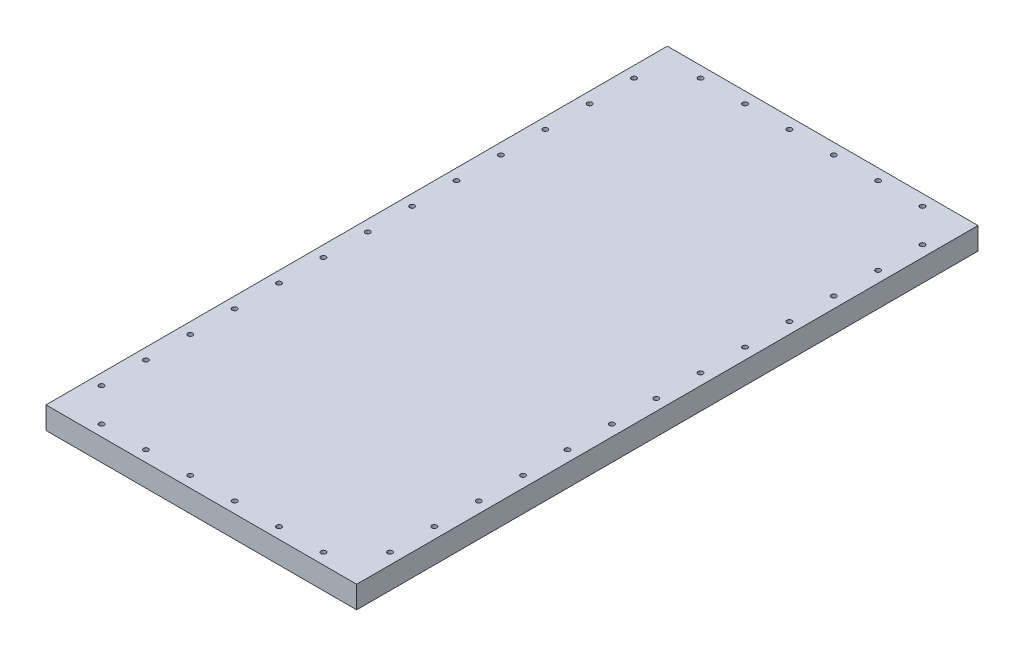
from build123d import *

# Parameters (mm, degrees)
SKETCH1_W                                         = 533.4
SKETCH1_H                                         = 38.1
BOSS_EXTRUDE1_DEPTH                               = 1066.8
CSK_FOR_5_16_FLAT_HEAD_MACHINE_SCREW1_D           = 8.4328
CSK_FOR_5_16_FLAT_HEAD_MACHINE_SCREW1_CSINK_D     = 16.129
CSK_FOR_5_16_FLAT_HEAD_MACHINE_SCREW1_CSINK_ANGLE = 82
CSK_FOR_5_16_FLAT_HEAD_MACHINE_SCREW2_D           = 8.4328
CSK_FOR_5_16_FLAT_HEAD_MACHINE_SCREW2_CSINK_D     = 16.129
CSK_FOR_5_16_FLAT_HEAD_MACHINE_SCREW2_CSINK_ANGLE = 82


with BuildPart() as part:
    # Sketch1 → Boss-Extrude1 (new body)
    with BuildSketch(Plane.XY):
        Rectangle(SKETCH1_W, SKETCH1_H)
    extrude(amount=BOSS_EXTRUDE1_DEPTH)

    # CSK for 5/16 Flat Head Machine Screw1 (through all)
    with Locations(Plane(origin=(0, -19.05, 0), x_dir=(-1, 0, 0), z_dir=(0, -1, 0))):
        with Locations((190.5, -1047.75), (114.3, -1047.75), (38.1, -1047.75), (-38.1, -1047.75), (-114.3, -1047.75), (-190.5, -1047.75), (114.3, -19.05), (38.1, -19.05), (-38.1, -19.05), (-114.3, -19.05), (-190.5, -19.05), (190.5, -19.05)):
            CounterSinkHole(CSK_FOR_5_16_FLAT_HEAD_MACHINE_SCREW1_D / 2, CSK_FOR_5_16_FLAT_HEAD_MACHINE_SCREW1_CSINK_D / 2, counter_sink_angle=CSK_FOR_5_16_FLAT_HEAD_MACHINE_SCREW1_CSINK_ANGLE)

    # CSK for 5/16 Flat Head Machine Screw2 (through all)
    with Locations(Plane(origin=(0, -19.05, 0), x_dir=(-1, 0, 0), z_dir=(0, -1, 0))):
        with Locations((-247.65, -76.2), (-247.65, -152.4), (-247.65, -228.6), (-247.65, -304.8), (-247.65, -381), (-247.65, -457.2), (-247.65, -533.4), (-247.65, -609.6), (-247.65, -685.8), (-247.65, -762), (247.65, -76.2), (247.65, -152.4), (247.65, -228.6), (247.65, -304.8), (247.65, -381), (247.65, -457.2), (247.65, -533.4), (247.65, -609.6), (247.65, -685.8), (247.65, -762), (-247.65, -838.2), (247.65, -838.2), (-247.65, -914.4), (247.65, -914.4), (-247.65, -990.6), (247.65, -990.6)):
            CounterSinkHole(CSK_FOR_5_16_FLAT_HEAD_MACHINE_SCREW2_D / 2, CSK_FOR_5_16_FLAT_HEAD_MACHINE_SCREW2_CSINK_D / 2, counter_sink_angle=CSK_FOR_5_16_FLAT_HEAD_MACHINE_SCREW2_CSINK_ANGLE)


solid = part.part
